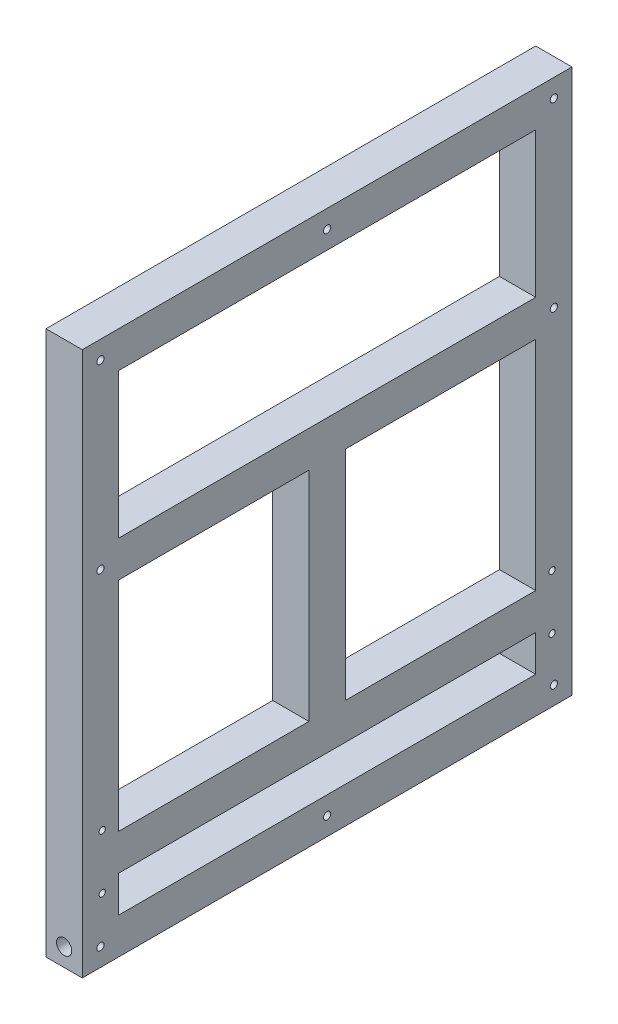
from build123d import *

# Parameters (mm, degrees)
SKETCH3_W           = 20
SKETCH3_H           = 20
BOSS_EXTRUDE1_DEPTH = 300
SKETCH5_W           = 20
SKETCH5_H           = 20
BOSS_EXTRUDE4_DEPTH = 250
SKETCH8_W           = 20
SKETCH8_H           = 20
BOSS_EXTRUDE5_DEPTH = 260
SKETCH13_W          = 230
SKETCH13_H          = 20
BOSS_EXTRUDE7_DEPTH = 20
BOSS_EXTRUDE8_DEPTH = 20
SKETCH15_W          = 20
SKETCH15_H          = 120
BOSS_EXTRUDE9_DEPTH = 20
SKETCH16_R          = 2
CUT_EXTRUDE1_DEPTH  = 20
SKETCH17_R          = 4.2
CUT_EXTRUDE2_DEPTH  = 270
SKETCH19_R          = 1.75
CUT_EXTRUDE3_DEPTH  = 78


with BuildPart() as part:
    # Sketch3 → Boss-Extrude1 (new body)
    with BuildSketch(Plane(origin=(0, 0, 0), x_dir=(1, 0, 0), z_dir=(0, 1, 0))):
        with Locations((10, 10)):
            Rectangle(SKETCH3_W, SKETCH3_H)
    extrude(amount=BOSS_EXTRUDE1_DEPTH)

    # Sketch5 → Boss-Extrude4 (add)
    with BuildSketch(Plane(origin=(0, 0, -20), x_dir=(-1, 0, 0), z_dir=(0, 0, -1))):
        with Locations((-10, 10)):
            Rectangle(SKETCH5_W, SKETCH5_H)
        with Locations((-10, 290)):
            Rectangle(SKETCH5_W, SKETCH5_H)
    extrude(amount=BOSS_EXTRUDE4_DEPTH)

    # Sketch8 → Boss-Extrude5 (add)
    with BuildSketch(Plane(origin=(0, 20, 0), x_dir=(1, 0, 0), z_dir=(0, 1, 0))):
        with Locations((10, 260)):
            Rectangle(SKETCH8_W, SKETCH8_H)
    extrude(amount=BOSS_EXTRUDE5_DEPTH)

    # Sketch13 → Boss-Extrude7 (add)
    with BuildSketch(Plane.ZY):
        with Locations((-135, 50)):
            Rectangle(SKETCH13_W, SKETCH13_H)
    extrude(amount=-BOSS_EXTRUDE7_DEPTH)

    # Sketch14 → Boss-Extrude8 (add)
    with BuildSketch(Plane(origin=(20, 0, 0), x_dir=(0, 0, -1), z_dir=(1, 0, 0))):
        Polygon((125, 200), (20, 200), (20, 180), (125, 180), (145, 180), (250, 180), (250, 200), (145, 200), align=None)
    extrude(amount=-BOSS_EXTRUDE8_DEPTH)

    # Sketch15 → Boss-Extrude9 (add)
    with BuildSketch(Plane(origin=(20, 0, 0), x_dir=(0, 0, -1), z_dir=(1, 0, 0))):
        with Locations((135, 120)):
            Rectangle(SKETCH15_W, SKETCH15_H)
    extrude(amount=-BOSS_EXTRUDE9_DEPTH)

    # Sketch16 → Cut-Extrude1 (cut)
    with BuildSketch(Plane(origin=(20, 0, 0), x_dir=(0, 0, -1), z_dir=(1, 0, 0))):
        with Locations((10, 290)):
            Circle(SKETCH16_R)
        with Locations((10, 190)):
            Circle(SKETCH16_R)
        with Locations((10, 10)):
            Circle(SKETCH16_R)
        with Locations((135, 10)):
            Circle(SKETCH16_R)
        with Locations((135, 290)):
            Circle(SKETCH16_R)
        with Locations(Location((260, 10, 0), (0, 0, 180))):
            Circle(SKETCH16_R)
        with Locations(Location((260, 190, 0), (0, 0, 180))):
            Circle(SKETCH16_R)
        with Locations(Location((260, 290, 0), (0, 0, 180))):
            Circle(SKETCH16_R)
    extrude(amount=-CUT_EXTRUDE1_DEPTH, mode=Mode.SUBTRACT)

    # Sketch17 → Cut-Extrude2 (cut)
    with BuildSketch(Plane(origin=(0, 0, -270), x_dir=(-1, 0, 0), z_dir=(0, 0, -1))):
        with Locations((-10, 10)):
            Circle(SKETCH17_R)
    extrude(amount=-CUT_EXTRUDE2_DEPTH, mode=Mode.SUBTRACT)

    # Sketch19 → Cut-Extrude3 (cut)
    with BuildSketch(Plane(origin=(20, 0, 0), x_dir=(0, 0, -1), z_dir=(1, 0, 0))):
        with Locations((11, 35)):
            Circle(SKETCH19_R)
        with Locations((11, 65)):
            Circle(SKETCH19_R)
        with Locations((259, 35)):
            Circle(SKETCH19_R)
        with Locations((259, 65)):
            Circle(SKETCH19_R)
    extrude(amount=-CUT_EXTRUDE3_DEPTH, mode=Mode.SUBTRACT)


solid = part.part
